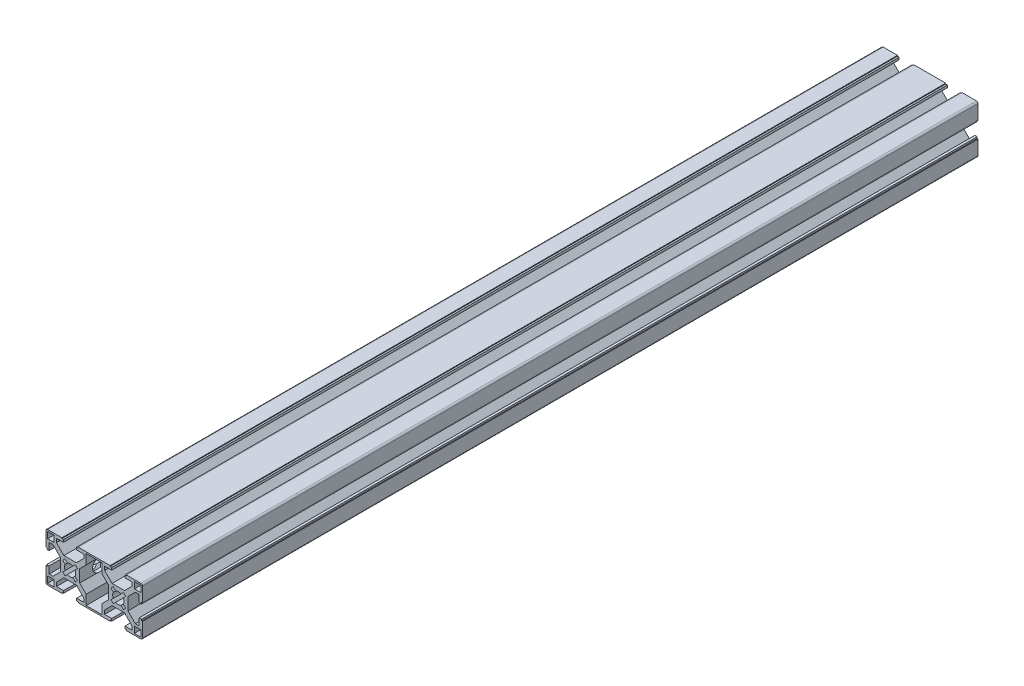
from build123d import *

# Parameters (mm, degrees)
ESBO_O1_W                      = 4
ESBO_O1_H                      = 4
RESSALTO_EXTRUS_O1_DEPTH       = 520
PADR_OCIRCULAR1_COUNT          = 4
PADR_O_LINEAR1_COUNT           = 2
PADR_O_LINEAR1_PITCH           = 30
PADR_O_LINEAR1_COPY_1_SKETCH_W = 4
PADR_O_LINEAR1_COPY_1_SKETCH_H = 4
PADR_O_LINEAR1_COPY_1_DEPTH    = 520
PADR_O_LINEAR1_COPY_2_SKETCH_W = 4
PADR_O_LINEAR1_COPY_2_SKETCH_H = 4
PADR_O_LINEAR1_COPY_2_DEPTH    = 520
PADR_O_LINEAR1_COPY_3_SKETCH_W = 4
PADR_O_LINEAR1_COPY_3_SKETCH_H = 4
PADR_O_LINEAR1_COPY_3_DEPTH    = 520
ESBO_O4_W                      = 10
ESBO_O4_H                      = 28
CORTE_EXTRUS_O1_DEPTH          = 523.158979622
FILETE1_R                      = 1
SKETCH1_R                      = 4
CUT_EXTRUDE1_DEPTH             = 523.710244782


with BuildPart() as part:
    # Esboço1 → Ressalto-extrusão1 (new body)
    with BuildSketch(Plane.XY):
        with BuildLine():
            ThreePointArc((-1.664601464, 3.078815026), (-0.858529967, 3.393070335), (0, 3.5))
            Line((0, 3.5), (0, 6))
            Line((0, 6), (-3.878679656, 6))
            Line((-3.878679656, 6), (-8.5, 10.621320344))
            Line((-8.5, 10.621320344), (-8.5, 13))
            Line((-8.5, 13), (-4.1, 13))
            Line((-4.1, 13), (-4.1, 14.5))
            Line((-4.1, 14.5), (-5.1, 14.5))
            Line((-5.1, 14.5), (-5.1, 15))
            Line((-5.1, 15), (-15, 15))
            Line((-15, 15), (-15, 5.1))
            Line((-15, 5.1), (-14.5, 5.1))
            Line((-14.5, 5.1), (-14.5, 4.1))
            Line((-14.5, 4.1), (-13, 4.1))
            Line((-13, 4.1), (-13, 8.5))
            Line((-13, 8.5), (-10.621320344, 8.5))
            Line((-10.621320344, 8.5), (-6, 3.878679656))
            Line((-6, 3.878679656), (-6, 0))
            Line((-6, 0), (-3.5, 0))
            ThreePointArc((-3.5, 0), (-3.393070335, 0.858529967), (-3.078815026, 1.664601464))
            Line((-3.078815026, 1.664601464), (-4.596194078, 3.181980515))
            Line((-4.596194078, 3.181980515), (-3.181980515, 4.596194078))
            Line((-3.181980515, 4.596194078), (-1.664601464, 3.078815026))
        make_face()
        with Locations((-12, 12)):
            Rectangle(ESBO_O1_W, ESBO_O1_H, mode=Mode.SUBTRACT)
    ressalto_extrus_o1 = extrude(amount=RESSALTO_EXTRUS_O1_DEPTH)

    # PadrãoCircular1: Ressalto-extrusão1 ×4 about axis
    padr_ocircular1_axis = Axis((0, 0, 0), (0, 0, 1))
    for i in range(1, PADR_OCIRCULAR1_COUNT):
        add(ressalto_extrus_o1.rotate(padr_ocircular1_axis, i * 360 / PADR_OCIRCULAR1_COUNT))

    # Padrão linear1: Ressalto-extrusão1 ×2
    with Locations(*[(i * PADR_O_LINEAR1_PITCH, 0, 0) for i in range(1, PADR_O_LINEAR1_COUNT)]):
        add(ressalto_extrus_o1)

    # Padrão linear1 copy 1 sketch → Padrão linear1 copy 1 (add)
    with BuildSketch(Plane(origin=(30, 0, 0), x_dir=(0, 1, 0), z_dir=(0, 0, 1))):
        with BuildLine():
            ThreePointArc((-1.664601464, 3.078815026), (-0.858529967, 3.393070335), (0, 3.5))
            Line((0, 3.5), (0, 6))
            Line((0, 6), (-3.878679656, 6))
            Line((-3.878679656, 6), (-8.5, 10.621320344))
            Line((-8.5, 10.621320344), (-8.5, 13))
            Line((-8.5, 13), (-4.1, 13))
            Line((-4.1, 13), (-4.1, 14.5))
            Line((-4.1, 14.5), (-5.1, 14.5))
            Line((-5.1, 14.5), (-5.1, 15))
            Line((-5.1, 15), (-15, 15))
            Line((-15, 15), (-15, 5.1))
            Line((-15, 5.1), (-14.5, 5.1))
            Line((-14.5, 5.1), (-14.5, 4.1))
            Line((-14.5, 4.1), (-13, 4.1))
            Line((-13, 4.1), (-13, 8.5))
            Line((-13, 8.5), (-10.621320344, 8.5))
            Line((-10.621320344, 8.5), (-6, 3.878679656))
            Line((-6, 3.878679656), (-6, 0))
            Line((-6, 0), (-3.5, 0))
            ThreePointArc((-3.5, 0), (-3.393070335, 0.858529967), (-3.078815026, 1.664601464))
            Line((-3.078815026, 1.664601464), (-4.596194078, 3.181980515))
            Line((-4.596194078, 3.181980515), (-3.181980515, 4.596194078))
            Line((-3.181980515, 4.596194078), (-1.664601464, 3.078815026))
        make_face()
        with Locations((-12, 12)):
            Rectangle(PADR_O_LINEAR1_COPY_1_SKETCH_W, PADR_O_LINEAR1_COPY_1_SKETCH_H, mode=Mode.SUBTRACT)
    extrude(amount=PADR_O_LINEAR1_COPY_1_DEPTH)

    # Padrão linear1 copy 2 sketch → Padrão linear1 copy 2 (add)
    with BuildSketch(Plane(origin=(30, 0, 0), x_dir=(-1, 0, 0), z_dir=(0, 0, 1))):
        with BuildLine():
            ThreePointArc((-1.664601464, 3.078815026), (-0.858529967, 3.393070335), (0, 3.5))
            Line((0, 3.5), (0, 6))
            Line((0, 6), (-3.878679656, 6))
            Line((-3.878679656, 6), (-8.5, 10.621320344))
            Line((-8.5, 10.621320344), (-8.5, 13))
            Line((-8.5, 13), (-4.1, 13))
            Line((-4.1, 13), (-4.1, 14.5))
            Line((-4.1, 14.5), (-5.1, 14.5))
            Line((-5.1, 14.5), (-5.1, 15))
            Line((-5.1, 15), (-15, 15))
            Line((-15, 15), (-15, 5.1))
            Line((-15, 5.1), (-14.5, 5.1))
            Line((-14.5, 5.1), (-14.5, 4.1))
            Line((-14.5, 4.1), (-13, 4.1))
            Line((-13, 4.1), (-13, 8.5))
            Line((-13, 8.5), (-10.621320344, 8.5))
            Line((-10.621320344, 8.5), (-6, 3.878679656))
            Line((-6, 3.878679656), (-6, 0))
            Line((-6, 0), (-3.5, 0))
            ThreePointArc((-3.5, 0), (-3.393070335, 0.858529967), (-3.078815026, 1.664601464))
            Line((-3.078815026, 1.664601464), (-4.596194078, 3.181980515))
            Line((-4.596194078, 3.181980515), (-3.181980515, 4.596194078))
            Line((-3.181980515, 4.596194078), (-1.664601464, 3.078815026))
        make_face()
        with Locations((-12, 12)):
            Rectangle(PADR_O_LINEAR1_COPY_2_SKETCH_W, PADR_O_LINEAR1_COPY_2_SKETCH_H, mode=Mode.SUBTRACT)
    extrude(amount=PADR_O_LINEAR1_COPY_2_DEPTH)

    # Padrão linear1 copy 3 sketch → Padrão linear1 copy 3 (add)
    with BuildSketch(Plane(origin=(30, 0, 0), x_dir=(0, -1, 0), z_dir=(0, 0, 1))):
        with BuildLine():
            ThreePointArc((-1.664601464, 3.078815026), (-0.858529967, 3.393070335), (0, 3.5))
            Line((0, 3.5), (0, 6))
            Line((0, 6), (-3.878679656, 6))
            Line((-3.878679656, 6), (-8.5, 10.621320344))
            Line((-8.5, 10.621320344), (-8.5, 13))
            Line((-8.5, 13), (-4.1, 13))
            Line((-4.1, 13), (-4.1, 14.5))
            Line((-4.1, 14.5), (-5.1, 14.5))
            Line((-5.1, 14.5), (-5.1, 15))
            Line((-5.1, 15), (-15, 15))
            Line((-15, 15), (-15, 5.1))
            Line((-15, 5.1), (-14.5, 5.1))
            Line((-14.5, 5.1), (-14.5, 4.1))
            Line((-14.5, 4.1), (-13, 4.1))
            Line((-13, 4.1), (-13, 8.5))
            Line((-13, 8.5), (-10.621320344, 8.5))
            Line((-10.621320344, 8.5), (-6, 3.878679656))
            Line((-6, 3.878679656), (-6, 0))
            Line((-6, 0), (-3.5, 0))
            ThreePointArc((-3.5, 0), (-3.393070335, 0.858529967), (-3.078815026, 1.664601464))
            Line((-3.078815026, 1.664601464), (-4.596194078, 3.181980515))
            Line((-4.596194078, 3.181980515), (-3.181980515, 4.596194078))
            Line((-3.181980515, 4.596194078), (-1.664601464, 3.078815026))
        make_face()
        with Locations((-12, 12)):
            Rectangle(PADR_O_LINEAR1_COPY_3_SKETCH_W, PADR_O_LINEAR1_COPY_3_SKETCH_H, mode=Mode.SUBTRACT)
    extrude(amount=PADR_O_LINEAR1_COPY_3_DEPTH)

    # Esboço4 → Corte-extrusão1 (cut, through all)
    with BuildSketch(Plane(origin=(0, 0, 0), x_dir=(-1, 0, 0), z_dir=(0, 0, -1))):
        with Locations((-15, 0)):
            Rectangle(ESBO_O4_W, ESBO_O4_H)
    extrude(amount=-CORTE_EXTRUS_O1_DEPTH, mode=Mode.SUBTRACT)

    # Filete1
    filete1_edges = [part.edges().sort_by_distance(p)[0] for p in [
        (45, -15, 260),
        (45, 15, 260),
        (-15, 15, 260),
        (-15, -15, 260),
    ]]
    fillet(filete1_edges, radius=FILETE1_R)

    # Sketch1 → Cut-Extrude1 (cut, symmetric)
    with BuildSketch(Plane.ZY.offset(6)):
        with Locations(Location((12, 0, 0), (0, 0, 255.852546084))):
            Circle(SKETCH1_R)
    cut_extrude1 = extrude(amount=CUT_EXTRUDE1_DEPTH, both=True, mode=Mode.SUBTRACT)

    # Mirror1: Cut-Extrude1 across plane
    add(cut_extrude1.mirror(Plane.XY.offset(260)), mode=Mode.SUBTRACT)


solid = part.part
